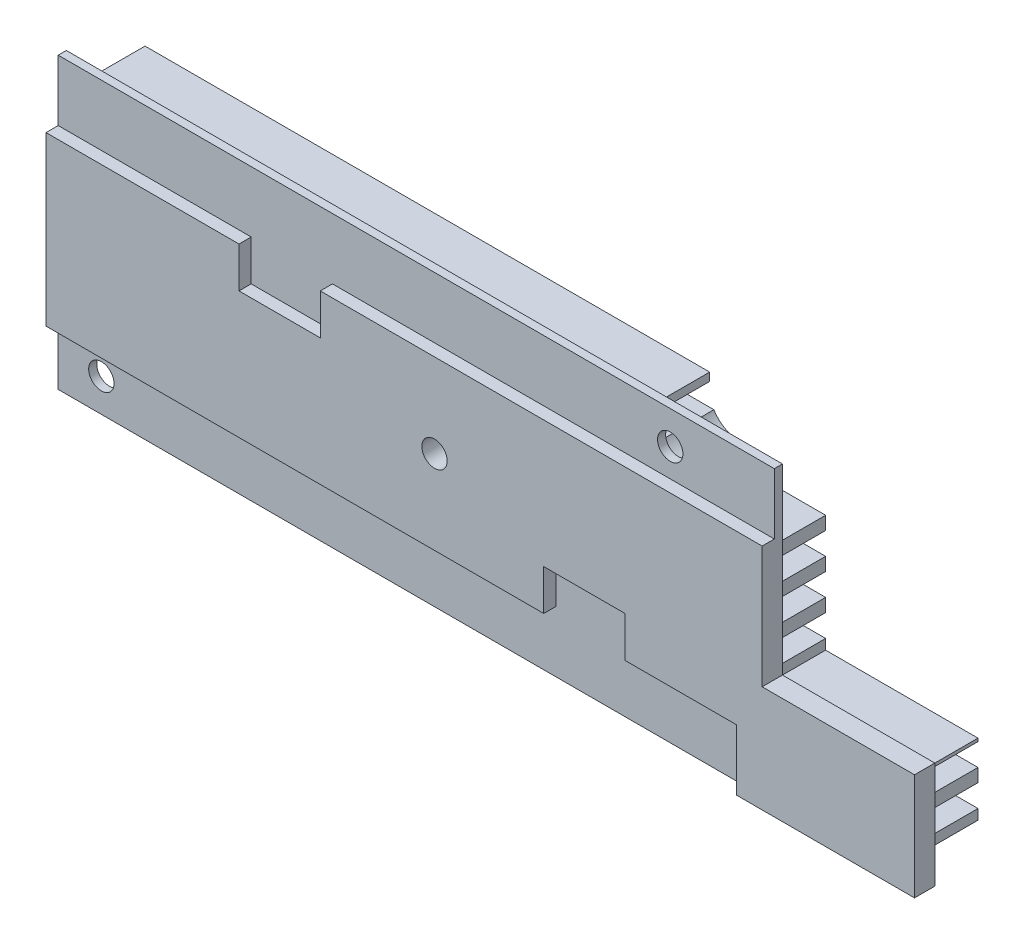
from build123d import *

# Parameters (mm, degrees)
BOSS_EXTRU_1_DEPTH      = 2
BOSS_EXTRU_2_DEPTH      = 6
ESQUISSE3_R             = 1.25
ENL_V_MAT_EXTRU_1_DEPTH = 148.965253472
ESQUISSE4_R             = 2.915475947
ENL_V_MAT_EXTRU_2_DEPTH = 6
ENL_V_MAT_EXTRU_3_DEPTH = 1.2
ESQUISSE12_W            = 85.5
ESQUISSE12_H            = 2.2
ENL_V_MAT_EXTRU_4_DEPTH = 6


with BuildPart() as part:
    # Esquisse1 → Boss.-Extru.1 (new body)
    with BuildSketch(Plane(origin=(0, 0, 59.701801036), x_dir=(-1, 0, 0), z_dir=(0, 0, -1))):
        Polygon((0.68526114, 91.507570583), (86.18526114, 91.507570583), (86.18526114, 120.007570583), (15.68526114, 120.007570583), (15.68526114, 102.007570583), (0.68526114, 102.007570583), align=None)
    extrude(amount=BOSS_EXTRU_1_DEPTH)

    # Esquisse2 → Boss.-Extru.2 (add)
    with BuildSketch(Plane(origin=(0, 0, 57.701801036), x_dir=(-1, 0, 0), z_dir=(0, 0, -1))):
        Polygon((84.43526114, 93.257570583), (84.43526114, 118.257570583), (17.43526114, 118.257570583), (17.43526114, 100.257570583), (2.43526114, 100.257570583), (2.43526114, 93.257570583), align=None)
    extrude(amount=BOSS_EXTRU_2_DEPTH)

    # Esquisse3 → Enlèv. mat.-Extru.1 (cut, through all)
    with BuildSketch(Plane(origin=(0, 0, 51.701801036), x_dir=(-1, 0, 0), z_dir=(0, 0, -1))):
        with Locations((47.93526114, 105.757570583)):
            Circle(ESQUISSE3_R)
        with Locations((25.93526114, 116.757570583)):
            Circle(ESQUISSE3_R)
        with Locations((81.93526114, 94.757570583)):
            Circle(ESQUISSE3_R)
    extrude(amount=-ENL_V_MAT_EXTRU_1_DEPTH, mode=Mode.SUBTRACT)

    # Esquisse4 → Enlèv. mat.-Extru.2 (cut)
    with BuildSketch(Plane(origin=(0, 0, 51.701801036), x_dir=(-1, 0, 0), z_dir=(0, 0, -1))):
        with Locations((47.93526114, 105.757570583)):
            Circle(ESQUISSE4_R)
        with BuildLine():
            Line((25.93526114, 113.842094636), (17.43526114, 113.842094636))
            Line((17.43526114, 113.842094636), (17.43526114, 118.257570583))
            Line((17.43526114, 118.257570583), (28.850737087, 118.257570583))
            Line((28.850737087, 118.257570583), (28.850737087, 116.757570583))
            ThreePointArc((28.850737087, 116.757570583), (27.996813953, 114.696017771), (25.93526114, 113.842094636))
        make_face()
        with BuildLine():
            Line((79.019785192, 94.757570583), (79.019785192, 91.842094636))
            Line((79.019785192, 91.842094636), (84.850737087, 91.842094636))
            Line((84.850737087, 91.842094636), (84.850737087, 97.673046531))
            Line((84.850737087, 97.673046531), (81.93526114, 97.673046531))
            ThreePointArc((81.93526114, 97.673046531), (79.873708327, 96.819123396), (79.019785192, 94.757570583))
        make_face()
    extrude(amount=-ENL_V_MAT_EXTRU_2_DEPTH, mode=Mode.SUBTRACT)

    # Esquisse11 → Enlèv. mat.-Extru.3 (cut)
    with BuildSketch(Plane.XY.offset(59.701801036)):
        Polygon((-18.18526114, 91.507570583), (-18.18526114, 97.507570583), (-29.18526114, 97.507570583), (-29.18526114, 101.507570583), (-37.18526114, 101.507570583), (-37.18526114, 97.507570583), (-86.18526114, 97.507570583), (-86.18526114, 91.507570583), align=None)
        Polygon((-15.68526114, 114.007570583), (-59.18526114, 114.007570583), (-59.18526114, 110.007570583), (-67.18526114, 110.007570583), (-67.18526114, 114.007570583), (-86.18526114, 114.007570583), (-86.18526114, 120.007570583), (-15.68526114, 120.007570583), align=None)
    extrude(amount=-ENL_V_MAT_EXTRU_3_DEPTH, mode=Mode.SUBTRACT)

    # Esquisse12 → Enlèv. mat.-Extru.4 (cut)
    with BuildSketch(Plane(origin=(0, 0, 51.701801036), x_dir=(-1, 0, 0), z_dir=(0, 0, -1))):
        with Locations((43.43526114, 95.357570583)):
            Rectangle(ESQUISSE12_W, ESQUISSE12_H)
        with Locations((43.43526114, 98.857570583)):
            Rectangle(ESQUISSE12_W, ESQUISSE12_H)
        with Locations((43.43526114, 102.357570583)):
            Rectangle(ESQUISSE12_W, ESQUISSE12_H)
        with Locations((43.43526114, 105.857570583)):
            Rectangle(ESQUISSE12_W, ESQUISSE12_H)
        with Locations((43.43526114, 109.357570583)):
            Rectangle(ESQUISSE12_W, ESQUISSE12_H)
        with Locations((43.43526114, 112.857570583)):
            Rectangle(ESQUISSE12_W, ESQUISSE12_H)
        with Locations((43.43526114, 116.357570583)):
            Rectangle(ESQUISSE12_W, ESQUISSE12_H)
    extrude(amount=-ENL_V_MAT_EXTRU_4_DEPTH, mode=Mode.SUBTRACT)


solid = part.part
